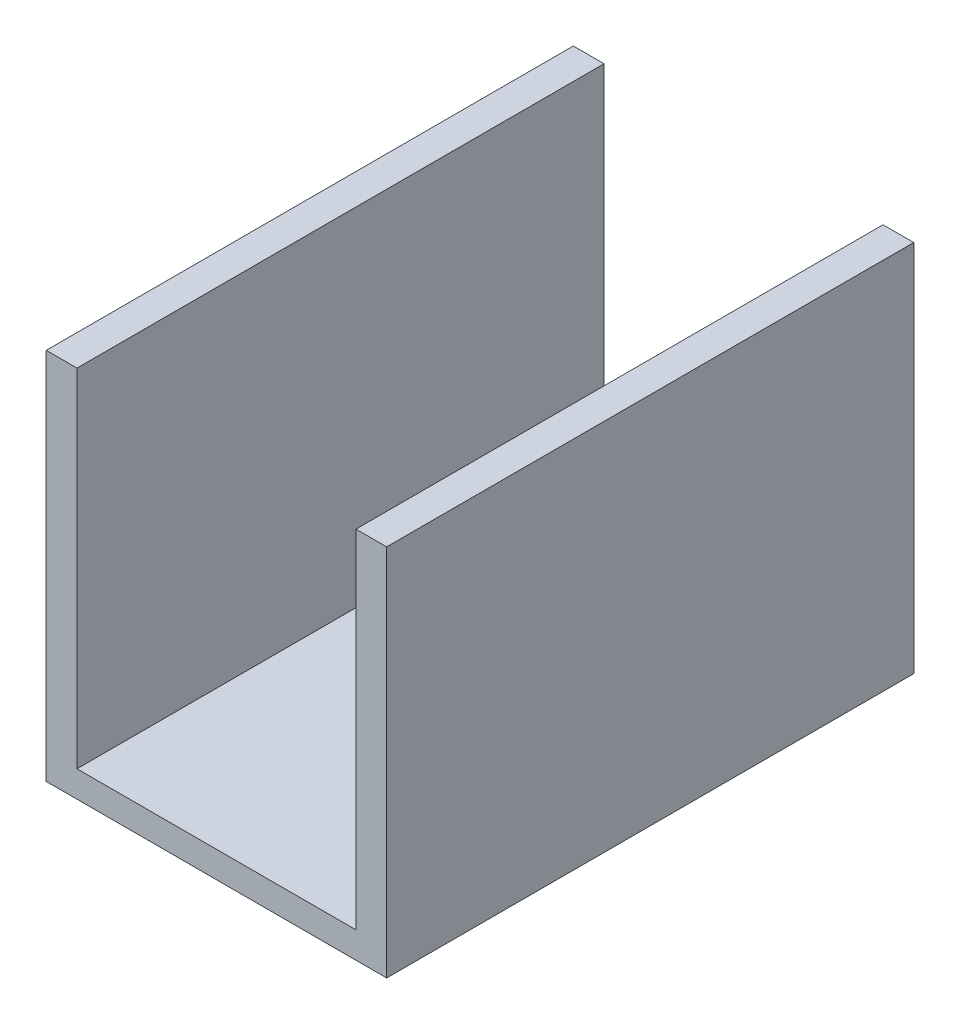
from build123d import *

# Parameters (mm, degrees)
BOSS_EXTRUDE1_DEPTH = 60


with BuildPart() as part:
    # Sketch2 → Boss-Extrude1 (new, symmetric)
    with BuildSketch(Plane.XY):
        Polygon((-31.75, 0), (31.75, 0), (31.75, 79), (38.75, 79), (38.75, -6), (-38.75, -6), (-38.75, 79), (-31.75, 79), align=None)
    extrude(amount=BOSS_EXTRUDE1_DEPTH, both=True)


solid = part.part
